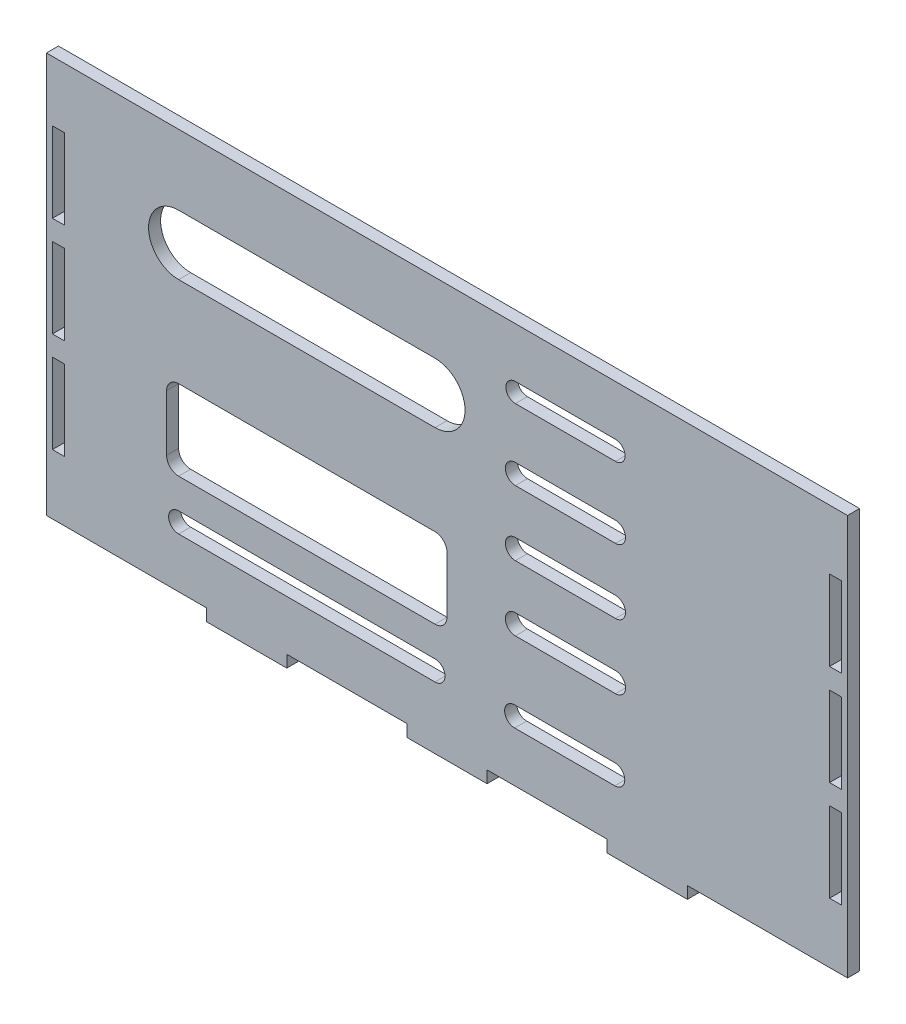
from build123d import *

# Parameters (mm, degrees)
SKETCH1_W           = 3
SKETCH1_H           = 20
BOSS_EXTRUDE1_DEPTH = 3


with BuildPart() as part:
    # Sketch1 → Boss-Extrude1 (new body)
    with BuildSketch(Plane.XY):
        Polygon((-100, -50), (-60, -50), (-60, -53), (-40, -53), (-40, -50), (-10, -50), (-10, -53), (10, -53), (10, -50), (40, -50), (40, -53), (60, -53), (60, -50), (100, -50), (100, 50), (-100, 50), align=None)
        with BuildLine():
            Line((-67, -25), (-3, -25))
            ThreePointArc((-3, -25), (-0.878679656, -24.121320344), (0, -22))
            Line((0, -22), (0, -8))
            ThreePointArc((0, -8), (-0.878679656, -5.878679656), (-3, -5))
            Line((-3, -5), (-67, -5))
            ThreePointArc((-67, -5), (-69.121320344, -5.878679656), (-70, -8))
            Line((-70, -8), (-70, -22))
            ThreePointArc((-70, -22), (-69.121320344, -24.121320344), (-67, -25))
        make_face(mode=Mode.SUBTRACT)
        with Locations((-97, 25)):
            Rectangle(SKETCH1_W, SKETCH1_H, mode=Mode.SUBTRACT)
        with Locations((-97, 0)):
            Rectangle(SKETCH1_W, SKETCH1_H, mode=Mode.SUBTRACT)
        with Locations((-97, -25)):
            Rectangle(SKETCH1_W, SKETCH1_H, mode=Mode.SUBTRACT)
        with Locations((97, 25.11339046)):
            Rectangle(SKETCH1_W, SKETCH1_H, mode=Mode.SUBTRACT)
        with Locations((97, 0)):
            Rectangle(SKETCH1_W, SKETCH1_H, mode=Mode.SUBTRACT)
        with Locations((97, -25)):
            Rectangle(SKETCH1_W, SKETCH1_H, mode=Mode.SUBTRACT)
        with BuildLine():
            Line((17.066389082, 37.5), (42.066389082, 37.5))
            ThreePointArc((42.066389082, 37.5), (44.452998622, 35.11339046), (42.066389082, 32.72678092))
            Line((42.066389082, 32.72678092), (17.066389082, 32.72678092))
            ThreePointArc((17.066389082, 32.72678092), (14.679779542, 35.11339046), (17.066389082, 37.5))
        make_face(mode=Mode.SUBTRACT)
        with BuildLine():
            Line((17.066389082, 20.00057963), (42.066389082, 20.00057963))
            ThreePointArc((42.066389082, 20.00057963), (44.566389082, 17.50057963), (42.066389082, 15.00057963))
            Line((42.066389082, 15.00057963), (17.066389082, 15.00057963))
            ThreePointArc((17.066389082, 15.00057963), (14.566389082, 17.50057963), (17.066389082, 20.00057963))
        make_face(mode=Mode.SUBTRACT)
        with BuildLine():
            Line((17.066389082, 3.766162691), (42.066389082, 3.766162691))
            ThreePointArc((42.066389082, 3.766162691), (44.566389082, 1.266162691), (42.066389082, -1.233837309))
            Line((42.066389082, -1.233837309), (17.066389082, -1.233837309))
            ThreePointArc((17.066389082, -1.233837309), (14.566389082, 1.266162691), (17.066389082, 3.766162691))
        make_face(mode=Mode.SUBTRACT)
        with BuildLine():
            Line((16.882588886, -32.5), (41.882588886, -32.5))
            ThreePointArc((41.882588886, -32.5), (44.382588886, -35), (41.882588886, -37.5))
            Line((41.882588886, -37.5), (16.882588886, -37.5))
            ThreePointArc((16.882588886, -37.5), (14.382588886, -35), (16.882588886, -32.5))
        make_face(mode=Mode.SUBTRACT)
        with BuildLine():
            Line((17.066389082, -12.5), (42.066389082, -12.5))
            ThreePointArc((42.066389082, -12.5), (44.566389082, -15), (42.066389082, -17.5))
            Line((42.066389082, -17.5), (17.066389082, -17.5))
            ThreePointArc((17.066389082, -17.5), (14.566389082, -15), (17.066389082, -12.5))
        make_face(mode=Mode.SUBTRACT)
        with BuildLine():
            Line((-67, 32.5), (-3, 32.5))
            ThreePointArc((-3, 32.5), (4.5, 25), (-3, 17.5))
            Line((-3, 17.5), (-67, 17.5))
            ThreePointArc((-67, 17.5), (-74.5, 25), (-67, 32.5))
        make_face(mode=Mode.SUBTRACT)
        with BuildLine():
            Line((-67, -32.5), (-3, -32.5))
            ThreePointArc((-3, -32.5), (-0.5, -35), (-3, -37.5))
            Line((-3, -37.5), (-67, -37.5))
            ThreePointArc((-67, -37.5), (-69.5, -35), (-67, -32.5))
        make_face(mode=Mode.SUBTRACT)
    extrude(amount=BOSS_EXTRUDE1_DEPTH)


solid = part.part
